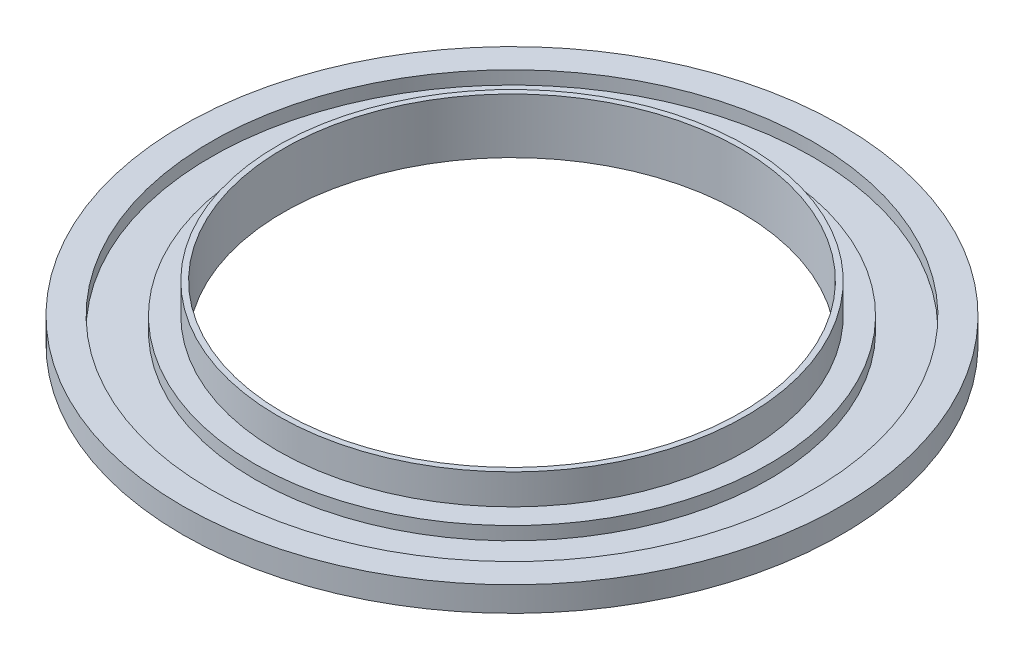
from build123d import *


with BuildPart() as part:
    # Sketch3 → Revolve1 (revolve)
    with BuildSketch(Plane(origin=(0, 0, 0), x_dir=(0, 0, -1), z_dir=(1, 0, 0))):
        Polygon((-212.5, 8.070339729), (-212.5, 35.553232656), (-207.5, 35.553232656), (-207.5, 8.070339729), (-207.5, -14.446767344), (-299, -14.446767344), (-299, 8.070339729), (-273.25, 8.070339729), (-273.25, -3.929660271), (-233.25, -3.929660271), (-233.25, 8.070339729), align=None)
    revolve(axis=Axis((0, 120.738006406, 0), (0, -1, 0)))


solid = part.part
